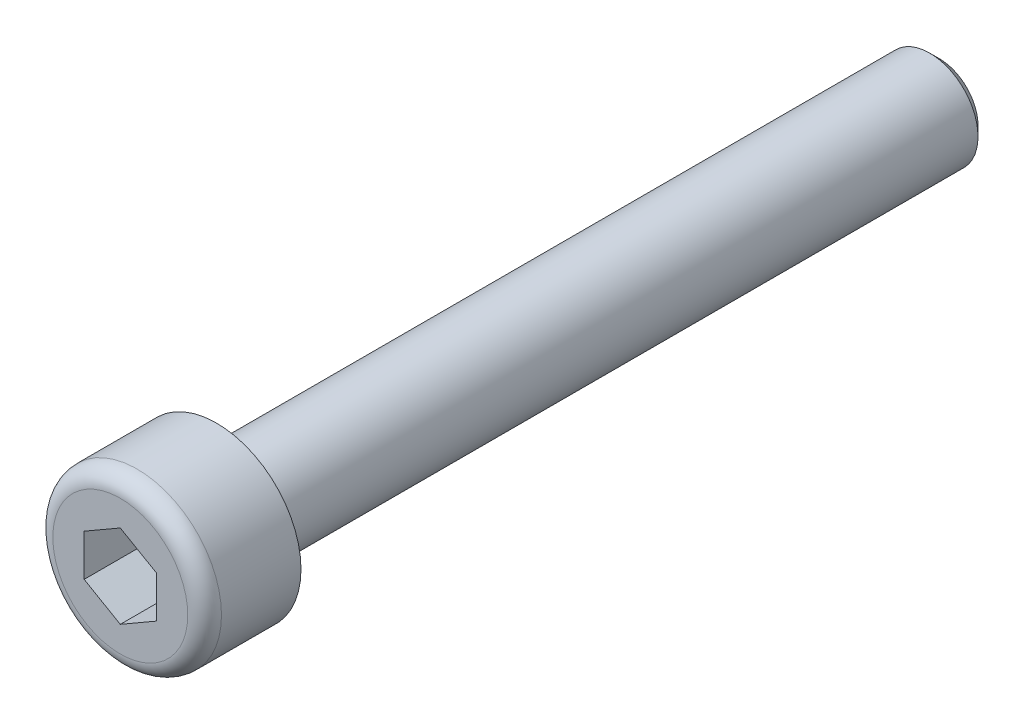
from build123d import *

# Parameters (mm, degrees)
ESQUISSE1_R             = 2
BASE_EXTRUSION_DEPTH    = 30
ESQUISSE2_R             = 3.5
BOSS_EXTRU_1_DEPTH      = 4
CHANFREIN1_SIZE         = 0.4
CONG_1_R                = 0.7
ENL_V_MAT_EXTRU_1_DEPTH = 2.5


with BuildPart() as part:
    # Esquisse1 → Base-Extrusion (new body)
    with BuildSketch(Plane.XY):
        Circle(ESQUISSE1_R)
    extrude(amount=BASE_EXTRUSION_DEPTH)

    # Esquisse2 → Boss.-Extru.1 (add)
    with BuildSketch(Plane.XY.offset(30)):
        Circle(ESQUISSE2_R)
    extrude(amount=BOSS_EXTRU_1_DEPTH)

    # Chanfrein1
    chanfrein1_edges = [part.edges().sort_by_distance(p)[0] for p in [
        (-2, 0, 0),
    ]]
    chamfer(chanfrein1_edges, length=CHANFREIN1_SIZE)

    # Congé1
    cong_1_edges = [part.edges().sort_by_distance(p)[0] for p in [
        (-3.5, 0, 34),
    ]]
    fillet(cong_1_edges, radius=CONG_1_R)

    # Esquisse3 → Enlèv. mat.-Extru.1 (cut)
    with BuildSketch(Plane.XY.offset(34)):
        Polygon((0, 1.732050808), (-1.5, 0.866025404), (-1.5, -0.866025404), (0, -1.732050808), (1.5, -0.866025404), (1.5, 0.866025404), align=None)
    extrude(amount=-ENL_V_MAT_EXTRU_1_DEPTH, mode=Mode.SUBTRACT)


solid = part.part
